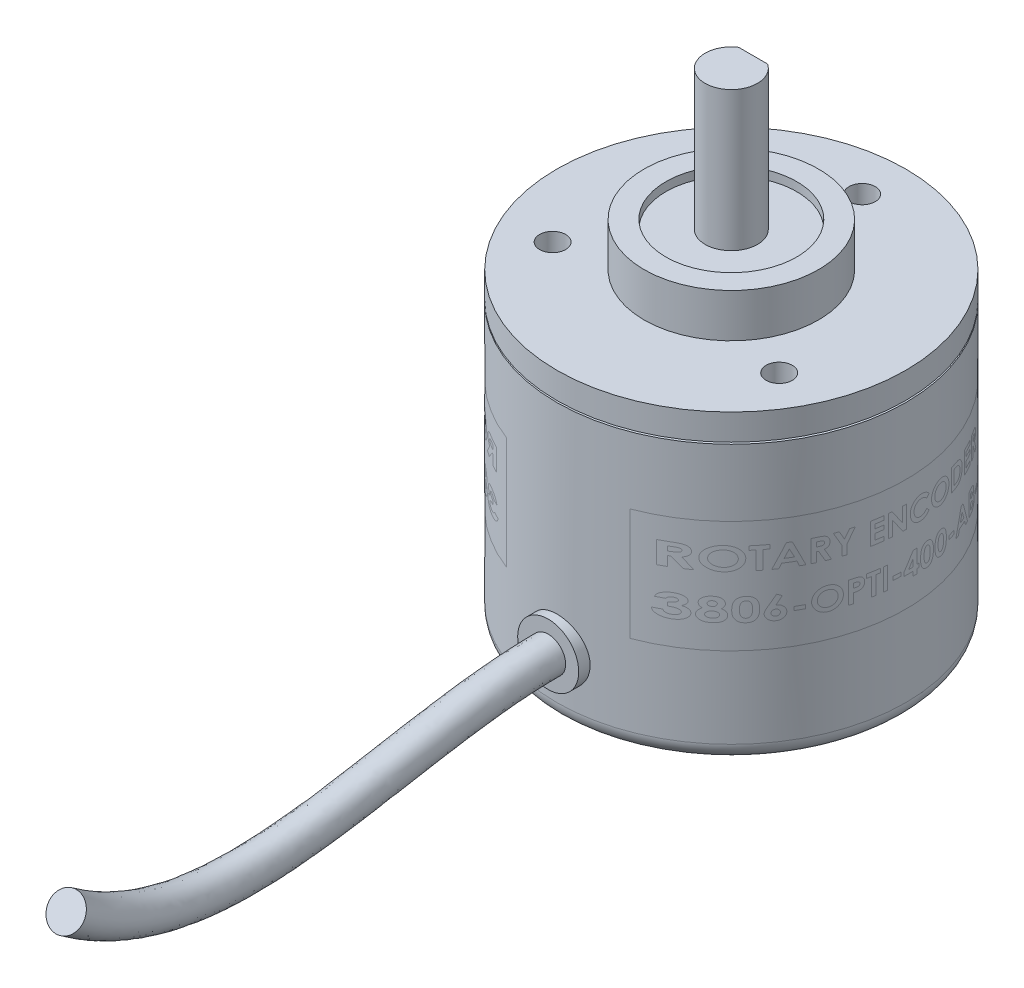
from build123d import *

# Parameters (mm, degrees)
SKETCH1_R           = 20
BOSS_EXTRUDE1_DEPTH = 35
SKETCH3_R           = 10
BOSS_EXTRUDE3_DEPTH = 5
SKETCH4_R           = 7.5
CUT_EXTRUDE1_DEPTH  = 1
SKETCH5_R           = 3
BOSS_EXTRUDE4_DEPTH = 16
SKETCH6_W           = 5.83666228
SKETCH6_H           = 4.189609368
CUT_EXTRUDE2_DEPTH  = 10
SKETCH10_W          = 2.171108564
SKETCH10_H          = 0.2
SKETCH11_R          = 3.5
BOSS_EXTRUDE5_DEPTH = 21
SKETCH12_R          = 2
FILLET1_R           = 2
SKETCH24_R          = 1.5
CUT_EXTRUDE3_DEPTH  = 6


with BuildPart() as part:
    # Sketch1 → Boss-Extrude1 (new body)
    with BuildSketch(Plane(origin=(0, 0, 0), x_dir=(1, 0, 0), z_dir=(0, 1, 0))):
        Circle(SKETCH1_R)
    extrude(amount=BOSS_EXTRUDE1_DEPTH)

    # Sketch3 → Boss-Extrude3 (add)
    with BuildSketch(Plane(origin=(0, 35, 0), x_dir=(1, 0, 0), z_dir=(0, 1, 0))):
        Circle(SKETCH3_R)
    extrude(amount=BOSS_EXTRUDE3_DEPTH)

    # Sketch4 → Cut-Extrude1 (cut)
    with BuildSketch(Plane(origin=(0, 40, 0), x_dir=(1, 0, 0), z_dir=(0, 1, 0))):
        Circle(SKETCH4_R)
    extrude(amount=-CUT_EXTRUDE1_DEPTH, mode=Mode.SUBTRACT)

    # Sketch5 → Boss-Extrude4 (add)
    with BuildSketch(Plane(origin=(0, 39, 0), x_dir=(1, 0, 0), z_dir=(0, 1, 0))):
        Circle(SKETCH5_R)
    extrude(amount=BOSS_EXTRUDE4_DEPTH)

    # Sketch6 → Cut-Extrude2 (cut)
    with BuildSketch(Plane(origin=(0, 55, 0), x_dir=(1, 0, 0), z_dir=(0, 1, 0))):
        with Locations((0, 4.594804684)):
            Rectangle(SKETCH6_W, SKETCH6_H)
    extrude(amount=-CUT_EXTRUDE2_DEPTH, mode=Mode.SUBTRACT)

    # Sketch10 → Cut-Revolve1 (revolve, cut)
    with BuildSketch(Plane.XY):
        with Locations((20, 31.9)):
            Rectangle(SKETCH10_W, SKETCH10_H)
    revolve(axis=Axis((0, 0, 0), (0, 1, 0)), mode=Mode.SUBTRACT)

    # Sketch11 → Boss-Extrude5 (add)
    with BuildSketch(Plane.XY):
        with Locations((0, 7.305759765)):
            Circle(SKETCH11_R)
    extrude(amount=BOSS_EXTRUDE5_DEPTH)

    # Sweep1: sweep along a path in Sketch13
    with BuildLine() as sweep1_path:  # in the path sketch's own coordinates; laid on its plane below (add() does not lay a ready-made edge on the line's plane)
        add(Edge.make_bspline(
            [(-21, 7.305759765), (-39.680829044, 7.305759765), (-58.658536918, -3.239081936), (-76.270922844, 9.376545434)],
            knots=[0, 0, 0, 0, 1, 1, 1, 1], degree=3))
    # Sketch12 → Sweep1 (sweep)
    with BuildSketch(Plane.XY.offset(21)):
        with Locations((0, 7.305759765)):
            Circle(SKETCH12_R)
    sweep(path=Plane(origin=(0, 0, 0), x_dir=(0, 0, -1), z_dir=(1, 0, 0)) * sweep1_path.line)

    # Fillet1
    fillet1_edges = [part.edges().sort_by_distance(p)[0] for p in [
        (-20, 0, 0),
    ]]
    fillet(fillet1_edges, radius=FILLET1_R)

    # Sketch24 → Cut-Extrude3 (cut)
    with BuildSketch(Plane(origin=(0, 35, 0), x_dir=(1, 0, 0), z_dir=(0, 1, 0))):
        with Locations((0, 15)):
            Circle(SKETCH24_R)
        with Locations((12.990381057, -7.5)):
            Circle(SKETCH24_R)
        with Locations((-12.990381057, -7.5)):
            Circle(SKETCH24_R)
    extrude(amount=-CUT_EXTRUDE3_DEPTH, mode=Mode.SUBTRACT)


solid = part.part
